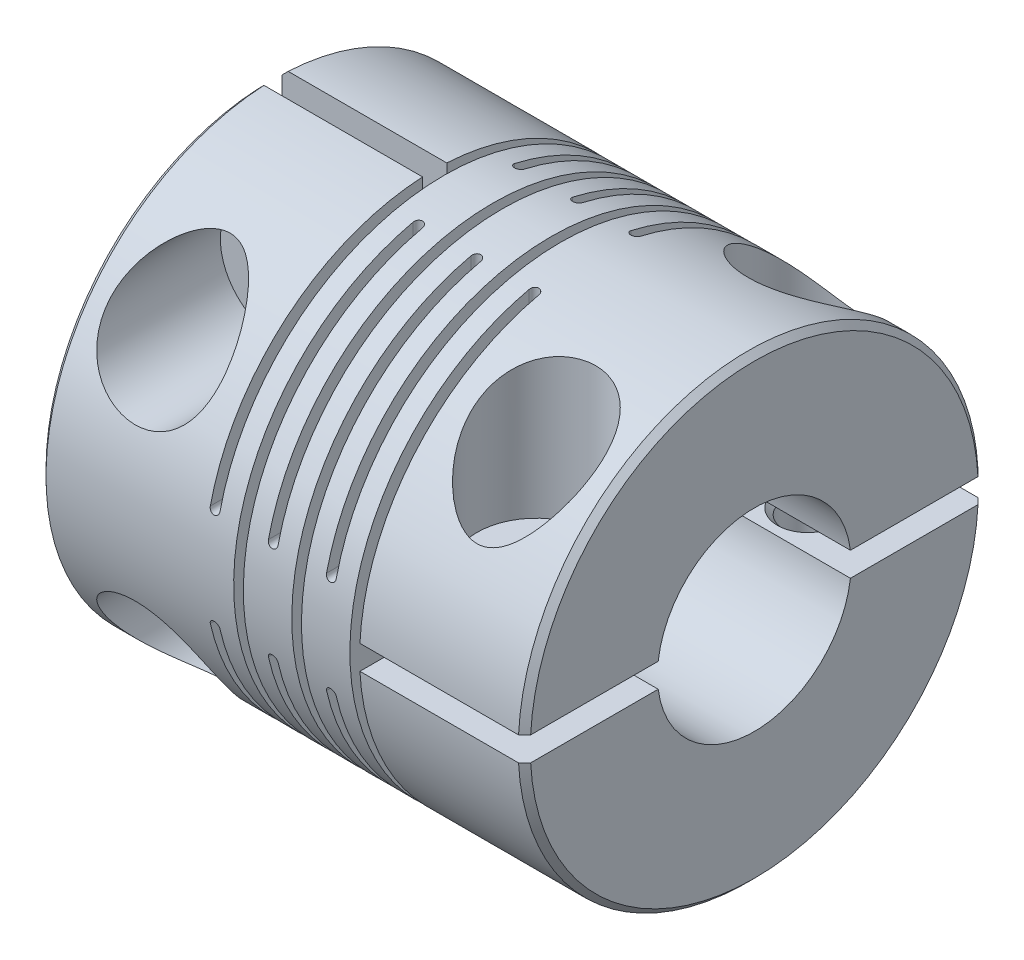
from build123d import *

# Parameters (mm, degrees)
CUT_EXTRUDE1_DEPTH      = 10
CUT_EXTRUDE1_DEPTH_BACK = 10
CUT_EXTRUDE2_DEPTH      = 10
CUT_EXTRUDE2_DEPTH_BACK = 10
CUT_EXTRUDE3_DEPTH      = 10
CUT_EXTRUDE3_DEPTH_BACK = 10
CUT_EXTRUDE4_DEPTH      = 10
CUT_EXTRUDE4_DEPTH_BACK = 10
SKETCH6_W               = 1
SKETCH6_H               = 19.4
CUT_EXTRUDE5_DEPTH      = 6.8
SKETCH7_W               = 19.4
SKETCH7_H               = 1
CUT_EXTRUDE6_DEPTH      = 6.8


with BuildPart() as part:
    # Sketch1 → Revolve1 (revolve)
    with BuildSketch(Plane.XY):
        Polygon((0, 9.25), (0, 2.5), (6.8, 2.5), (6.8, 4.25), (13.2, 4.25), (13.2, 4), (20, 4), (20, 9.25), (19.75, 9.5), (0.25, 9.5), align=None)
    revolve(axis=Axis((20, 0, 0), (-1, 0, 0)))

    # Sketch2 → Cut-Extrude1 (cut, two sides: drawn at the far end of the back side and taken through both)
    with BuildSketch(Plane.XY.offset(-CUT_EXTRUDE1_DEPTH_BACK)):
        with BuildLine():
            Line((6.8, -10), (12, -10))
            Line((12, -10), (12, -2.1))
            ThreePointArc((12, -2.1), (11.8, -1.9), (11.6, -2.1))
            Line((11.6, -2.1), (11.6, -9.75))
            Line((11.6, -9.75), (9.6, -9.75))
            Line((9.6, -9.75), (9.6, -2.1))
            ThreePointArc((9.6, -2.1), (9.4, -1.9), (9.2, -2.1))
            Line((9.2, -2.1), (9.2, -9.75))
            Line((9.2, -9.75), (7.2, -9.75))
            Line((7.2, -9.75), (7.2, -2.1))
            ThreePointArc((7.2, -2.1), (7, -1.9), (6.8, -2.1))
            Line((6.8, -2.1), (6.8, -10))
        make_face()
    extrude(amount=CUT_EXTRUDE1_DEPTH + CUT_EXTRUDE1_DEPTH_BACK, mode=Mode.SUBTRACT)

    # Sketch3 → Cut-Extrude2 (cut, two sides: drawn at the far end of the back side and taken through both)
    with BuildSketch(Plane.XY.offset(-CUT_EXTRUDE2_DEPTH_BACK)):
        with BuildLine():
            Line((6.8, 10), (6.8, 2.1))
            ThreePointArc((6.8, 2.1), (7, 1.9), (7.2, 2.1))
            Line((7.2, 2.1), (7.2, 9.75))
            Line((7.2, 9.75), (9.2, 9.75))
            Line((9.2, 9.75), (9.2, 2.1))
            ThreePointArc((9.2, 2.1), (9.4, 1.9), (9.6, 2.1))
            Line((9.6, 2.1), (9.6, 9.75))
            Line((9.6, 9.75), (11.6, 9.75))
            Line((11.6, 9.75), (11.6, 2.1))
            ThreePointArc((11.6, 2.1), (11.8, 1.9), (12, 2.1))
            Line((12, 2.1), (12, 10))
            Line((12, 10), (6.8, 10))
        make_face()
    extrude(amount=CUT_EXTRUDE2_DEPTH + CUT_EXTRUDE2_DEPTH_BACK, mode=Mode.SUBTRACT)

    # Sketch4 → Cut-Extrude3 (cut, two sides: drawn at the far end of the back side and taken through both)
    with BuildSketch(Plane(origin=(0, 0, 0), x_dir=(-1, 0, 0), z_dir=(0, 1, 0)).offset(-CUT_EXTRUDE3_DEPTH_BACK)):
        with BuildLine():
            Line((-8, 10), (-13.2, 10))
            Line((-13.2, 10), (-13.2, 2.1))
            ThreePointArc((-13.2, 2.1), (-13, 1.9), (-12.8, 2.1))
            Line((-12.8, 2.1), (-12.8, 9.75))
            Line((-12.8, 9.75), (-10.8, 9.75))
            Line((-10.8, 9.75), (-10.8, 2.1))
            ThreePointArc((-10.8, 2.1), (-10.6, 1.9), (-10.4, 2.1))
            Line((-10.4, 2.1), (-10.4, 9.75))
            Line((-10.4, 9.75), (-8.4, 9.75))
            Line((-8.4, 9.75), (-8.4, 2.1))
            ThreePointArc((-8.4, 2.1), (-8.2, 1.9), (-8, 2.1))
            Line((-8, 2.1), (-8, 10))
        make_face()
    extrude(amount=CUT_EXTRUDE3_DEPTH + CUT_EXTRUDE3_DEPTH_BACK, mode=Mode.SUBTRACT)

    # Sketch5 → Cut-Extrude4 (cut, two sides: drawn at the far end of the back side and taken through both)
    with BuildSketch(Plane(origin=(0, 0, 0), x_dir=(-1, 0, 0), z_dir=(0, 1, 0)).offset(-CUT_EXTRUDE4_DEPTH_BACK)):
        with BuildLine():
            Line((-8, -10), (-8, -2.1))
            ThreePointArc((-8, -2.1), (-8.2, -1.9), (-8.4, -2.1))
            Line((-8.4, -2.1), (-8.4, -9.75))
            Line((-8.4, -9.75), (-10.4, -9.75))
            Line((-10.4, -9.75), (-10.4, -2.1))
            ThreePointArc((-10.4, -2.1), (-10.6, -1.9), (-10.8, -2.1))
            Line((-10.8, -2.1), (-10.8, -9.75))
            Line((-10.8, -9.75), (-12.8, -9.75))
            Line((-12.8, -9.75), (-12.8, -2.1))
            ThreePointArc((-12.8, -2.1), (-13, -1.9), (-13.2, -2.1))
            Line((-13.2, -2.1), (-13.2, -10))
            Line((-13.2, -10), (-8, -10))
        make_face()
    extrude(amount=CUT_EXTRUDE4_DEPTH + CUT_EXTRUDE4_DEPTH_BACK, mode=Mode.SUBTRACT)

    # Sketch6 → Cut-Extrude5 (cut)
    with BuildSketch(Plane(origin=(0, 0, 0), x_dir=(0, 0, -1), z_dir=(1, 0, 0))):
        Rectangle(SKETCH6_W, SKETCH6_H)
    extrude(amount=CUT_EXTRUDE5_DEPTH, mode=Mode.SUBTRACT)

    # Sketch7 → Cut-Extrude6 (cut)
    with BuildSketch(Plane(origin=(20, 0, 0), x_dir=(0, 0, -1), z_dir=(1, 0, 0))):
        Rectangle(SKETCH7_W, SKETCH7_H)
    extrude(amount=-CUT_EXTRUDE6_DEPTH, mode=Mode.SUBTRACT)

    # Sketch8 → Cut-Revolve1 (revolve, cut)
    with BuildSketch(Plane(origin=(3.4, 0, 0), x_dir=(0, 0, -1), z_dir=(1, 0, 0))):
        Polygon((-9.5, 5.6), (-9.5, 8.05), (-3, 8.05), (-3, 6.85), (0.5, 6.85), (0.7435, 6.6065), (4.7565, 6.6065), (5, 6.85), (9.5, 6.85), (9.5, 5.6), align=None)
    revolve(axis=Axis((3.4, 5.6, -9.5), (0, 0, 1)), mode=Mode.SUBTRACT)

    # Sketch9 → Cut-Revolve2 (revolve, cut)
    with BuildSketch(Plane(origin=(3.4, 0, 0), x_dir=(0, 0, -1), z_dir=(1, 0, 0))):
        Polygon((-9.5, -5.6), (-9.5, -3.15), (-3, -3.15), (-3, -4.35), (0.5, -4.35), (0.7435, -4.5935), (4.7565, -4.5935), (5, -4.35), (9.5, -4.35), (9.5, -5.6), align=None)
    revolve(axis=Axis((3.4, -5.6, -9.5), (0, 0, 1)), mode=Mode.SUBTRACT)

    # Sketch10 → Cut-Revolve3 (revolve, cut)
    with BuildSketch(Plane(origin=(16.6, 0, 0), x_dir=(0, 0, -1), z_dir=(1, 0, 0))):
        Polygon((-5.6, -9.5), (-6.85, -9.5), (-6.85, -5), (-6.6065, -4.7565), (-6.6065, -0.7435), (-6.85, -0.5), (-6.85, 3), (-8.05, 3), (-8.05, 9.5), (-5.6, 9.5), align=None)
    revolve(axis=Axis((16.6, 9.5, 5.6), (0, -1, 0)), mode=Mode.SUBTRACT)

    # Sketch11 → Cut-Revolve4 (revolve, cut)
    with BuildSketch(Plane(origin=(16.6, 0, 0), x_dir=(0, 0, -1), z_dir=(1, 0, 0))):
        Polygon((5.6, -9.5), (4.35, -9.5), (4.35, -5), (4.5935, -4.7565), (4.5935, -0.7435), (4.35, -0.5), (4.35, 3), (3.15, 3), (3.15, 9.5), (5.6, 9.5), align=None)
    revolve(axis=Axis((16.6, 9.5, -5.6), (0, -1, 0)), mode=Mode.SUBTRACT)


solid = part.part
